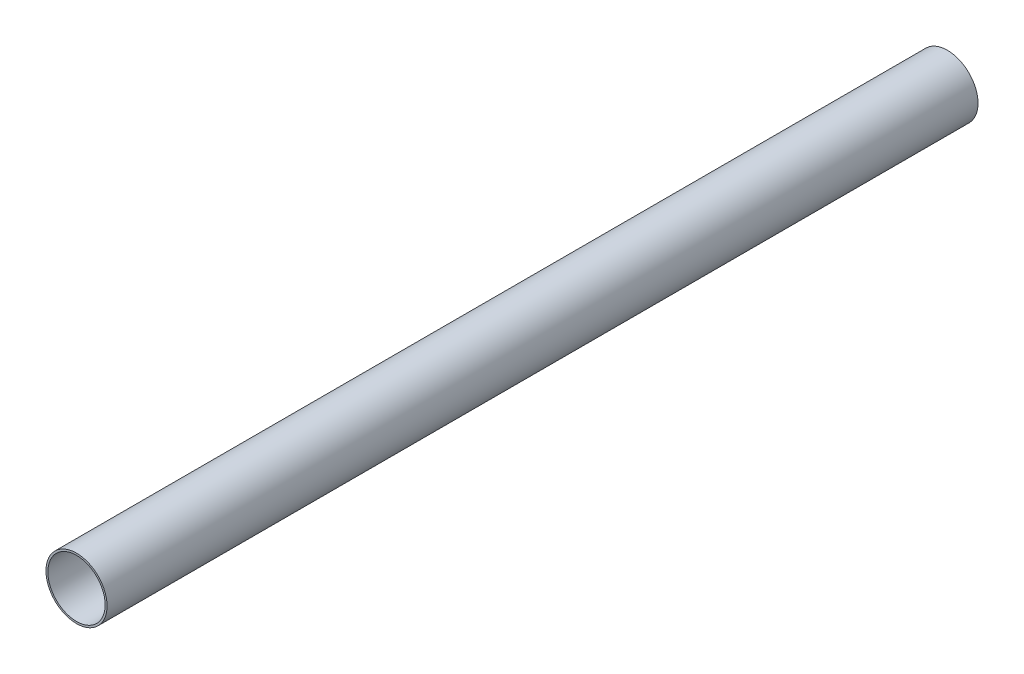
from build123d import *

# Parameters (mm, degrees)
SKETCH1_R           = 25.4
SKETCH1_R_2         = 23.8125
BOSS_EXTRUDE1_DEPTH = 723.9


with BuildPart() as part:
    # Sketch1 → Boss-Extrude1 (new body)
    with BuildSketch(Plane.XY):
        Circle(SKETCH1_R)
        Circle(SKETCH1_R_2, mode=Mode.SUBTRACT)
    extrude(amount=BOSS_EXTRUDE1_DEPTH)


solid = part.part
